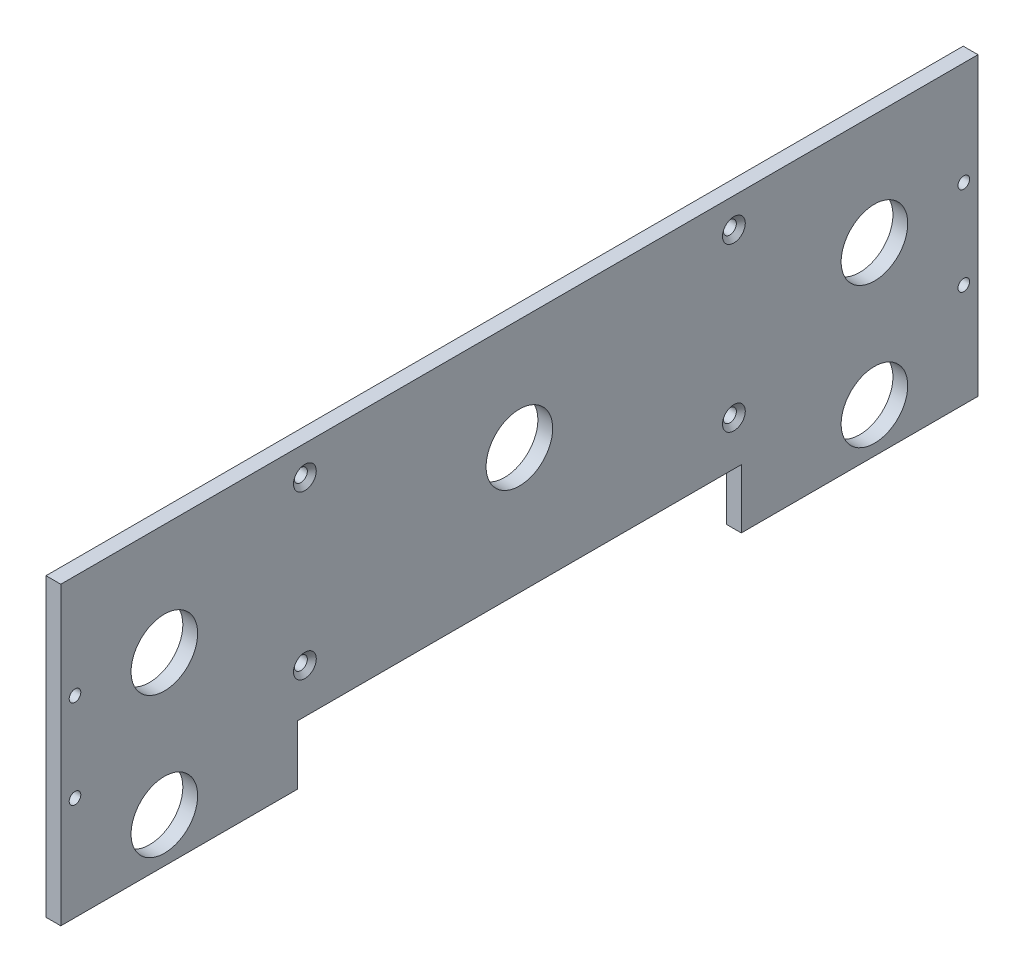
from build123d import *

# Parameters (mm, degrees)
SKETCH1_W                                          = 393.7
SKETCH1_H                                          = 127
BOSS_EXTRUDE1_DEPTH                                = 6.35
SKETCH2_R                                          = 14.2875
CUT_EXTRUDE1_DEPTH                                 = 207.935968357
F_10_CLEARANCE_HOLE1_D                             = 4.9784
CSK_FOR_10_FLAT_HEAD_MACHINE_SCREW_100_D           = 5.6134
CSK_FOR_10_FLAT_HEAD_MACHINE_SCREW_100_CSINK_D     = 9.779
CSK_FOR_10_FLAT_HEAD_MACHINE_SCREW_100_CSINK_ANGLE = 100
SKETCH23_W                                         = 190.5
SKETCH23_H                                         = 25.4
CUT_EXTRUDE6_DEPTH                                 = 207.935968357


with BuildPart() as part:
    # Sketch1 → Boss-Extrude1 (new body)
    with BuildSketch(Plane(origin=(0, 0, 0), x_dir=(0, 0, -1), z_dir=(1, 0, 0))):
        Rectangle(SKETCH1_W, SKETCH1_H)
    extrude(amount=BOSS_EXTRUDE1_DEPTH)

    # Sketch2 → Cut-Extrude1 (cut, through all)
    with BuildSketch(Plane(origin=(6.35, 0, 0), x_dir=(0, 0, -1), z_dir=(1, 0, 0))):
        with Locations((0, 15.875)):
            Circle(SKETCH2_R)
        with Locations((-152.4, 15.875)):
            Circle(SKETCH2_R)
        with Locations((152.4, 15.875)):
            Circle(SKETCH2_R)
        with Locations((-152.4, -44.45)):
            Circle(SKETCH2_R)
        with Locations((152.4, -44.45)):
            Circle(SKETCH2_R)
    extrude(amount=-CUT_EXTRUDE1_DEPTH, mode=Mode.SUBTRACT)

    # #10 Clearance Hole1 (through all)
    with Locations(Plane(origin=(6.35, 0, 0), x_dir=(0, 0, -1), z_dir=(1, 0, 0))):
        with Locations((-190.754, 19.05), (-190.754, -19.05), (190.754, 19.05), (190.754, -19.05)):
            Hole(F_10_CLEARANCE_HOLE1_D / 2)

    # CSK for #10 Flat Head Machine Screw (100)1 (through all)
    with Locations(Plane(origin=(6.35, 0, 0), x_dir=(0, 0, -1), z_dir=(1, 0, 0))):
        with Locations((-92.075, 50.8), (92.075, 50.8), (-92.075, -19.05), (92.075, -19.05)):
            CounterSinkHole(CSK_FOR_10_FLAT_HEAD_MACHINE_SCREW_100_D / 2, CSK_FOR_10_FLAT_HEAD_MACHINE_SCREW_100_CSINK_D / 2, counter_sink_angle=CSK_FOR_10_FLAT_HEAD_MACHINE_SCREW_100_CSINK_ANGLE)

    # Sketch23 → Cut-Extrude6 (cut, through all)
    with BuildSketch(Plane(origin=(6.35, 0, 0), x_dir=(0, 0, -1), z_dir=(1, 0, 0))):
        with Locations((0, -50.8)):
            Rectangle(SKETCH23_W, SKETCH23_H)
    extrude(amount=-CUT_EXTRUDE6_DEPTH, mode=Mode.SUBTRACT)


solid = part.part
